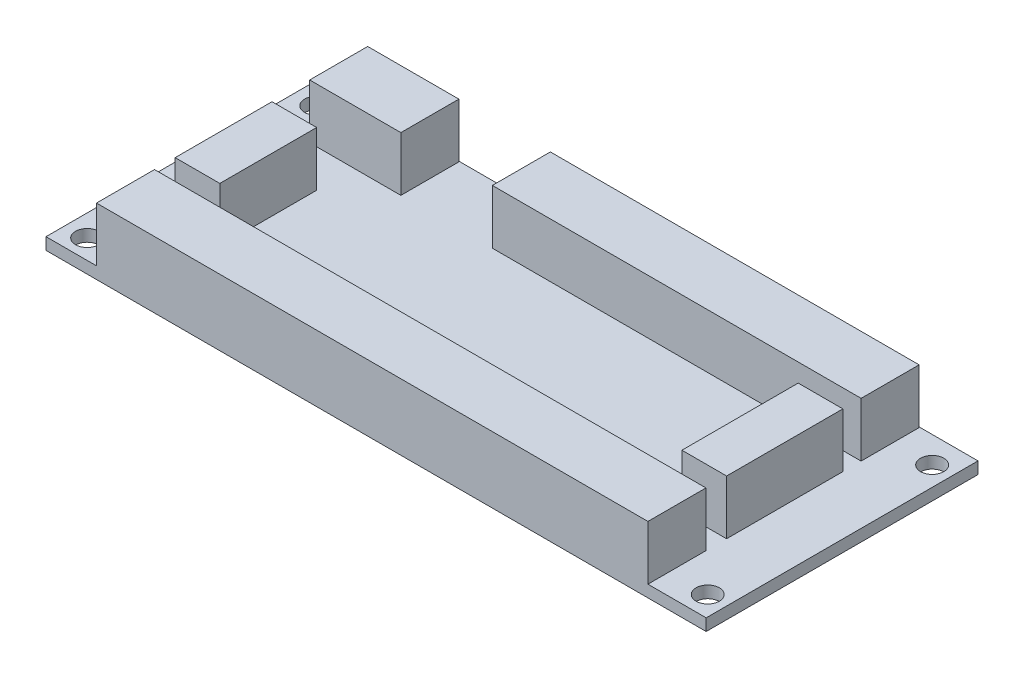
from build123d import *

# Parameters (mm, degrees)
SKETCH1_W           = 85
SKETCH1_H           = 35
SKETCH1_R           = 1.5
BOSS_EXTRUDE2_DEPTH = 1.53
SKETCH2_W           = 71
SKETCH2_H           = 7.47
SKETCH2_W_2         = 5.75
SKETCH2_H_2         = 14.97
SKETCH2_W_3         = 11.74
SKETCH2_W_4         = 47.48
SKETCH2_H_3         = 12.47
BOSS_EXTRUDE3_DEPTH = 7


with BuildPart() as part:
    # Sketch1 → Boss-Extrude2 (new body)
    with BuildSketch(Plane(origin=(0, 0, 0), x_dir=(1, 0, 0), z_dir=(0, 1, 0))):
        Rectangle(SKETCH1_W, SKETCH1_H)
        with Locations(Location((-39.7, 14.5, 0), (0, 0, 270))):
            Circle(SKETCH1_R, mode=Mode.SUBTRACT)
        with Locations(Location((-39.7, -15, 0), (0, 0, 270))):
            Circle(SKETCH1_R, mode=Mode.SUBTRACT)
        with Locations(Location((40, 14.1, 0), (0, 0, 270))):
            Circle(SKETCH1_R, mode=Mode.SUBTRACT)
        with Locations(Location((40, -14.8, 0), (0, 0, 270))):
            Circle(SKETCH1_R, mode=Mode.SUBTRACT)
    extrude(amount=BOSS_EXTRUDE2_DEPTH)

    # Sketch2 → Boss-Extrude3 (add)
    with BuildSketch(Plane(origin=(0, 1.53, 0), x_dir=(1, 0, 0), z_dir=(0, 1, 0))):
        with Locations((-0.5, -13.765)):
            Rectangle(SKETCH2_W, SKETCH2_H)
        with Locations((32.125, 0.115)):
            Rectangle(SKETCH2_W_2, SKETCH2_H_2)
        with Locations((-30.13, 13.685)):
            Rectangle(SKETCH2_W_3, SKETCH2_H)
        with Locations((11.26, 13.685)):
            Rectangle(SKETCH2_W_4, SKETCH2_H)
        with Locations((-33.125, -1.135)):
            Rectangle(SKETCH2_W_2, SKETCH2_H_3)
    extrude(amount=BOSS_EXTRUDE3_DEPTH)


solid = part.part
